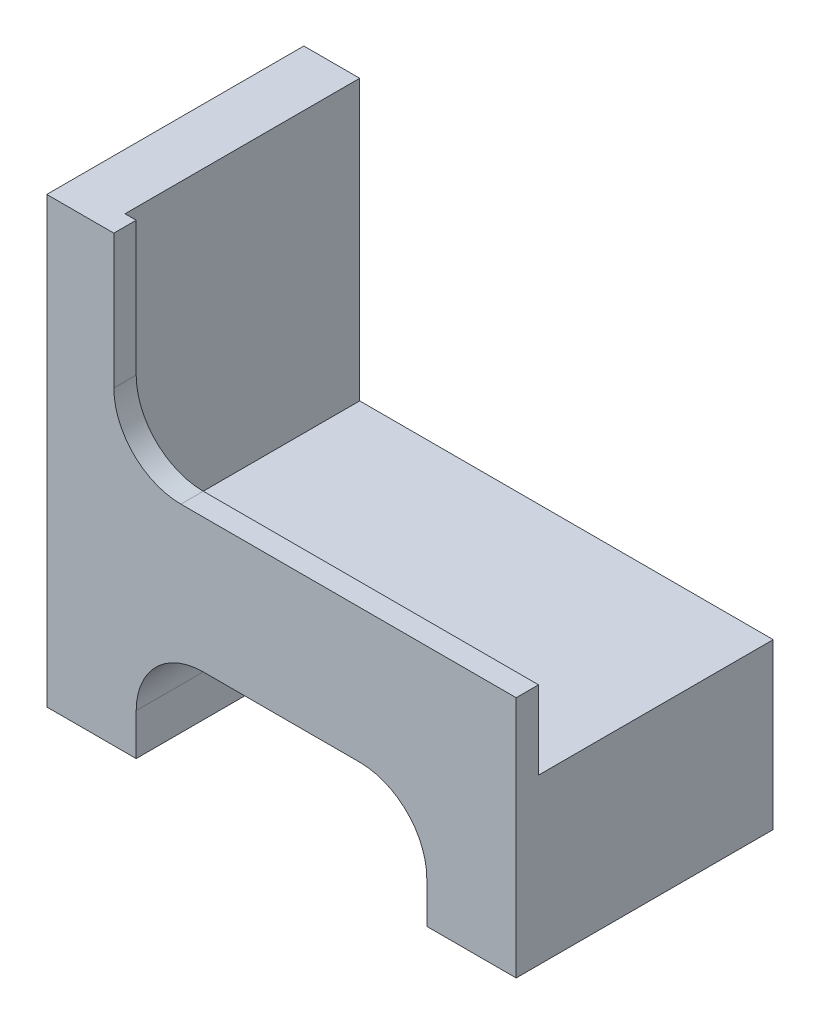
from build123d import *

# Parameters (mm, degrees)
EXTRUDE_1_DEPTH        = 10
SKETCH_2_R             = 0.95
CUT_EXTRUDE_1_DEPTH    = 5
FILLET_1_R             = 3
CHAMFER_2_SIZE         = 1
EXTRUDE_START          = 1.5
EXTRUDE_2_DEPTH        = 1.5
FILLET_2_R             = 3
SKETCH_5_W             = 18.894194267
SKETCH_5_H             = 13.568314004
CUT_EXTRUDE_1877_DEPTH = 10.5


with BuildPart() as part:
    # 草图1 → 凸台-拉伸1 (new body)
    with BuildSketch(Plane.XY):
        Polygon((0, 0), (18, 0), (18, -7.86), (14, -7.86), (14, -3), (1, -3), (1, -7.86), (-3, -7.86), (-3, 12), (0, 12), align=None)
    extrude(amount=EXTRUDE_1_DEPTH)

    # 草图2 → 切除-拉伸1 (cut)
    with BuildSketch(Plane.XZ.offset(7.86)):
        with Locations((-1, 5)):
            Circle(SKETCH_2_R)
        with Locations((16, 5.10136652)):
            Circle(SKETCH_2_R)
    extrude(amount=-CUT_EXTRUDE_1_DEPTH, mode=Mode.SUBTRACT)

    # 圆角1
    fillet_1_edges = [part.edges().sort_by_distance(p)[0] for p in [
        (14, -3, 5),
        (1, -3, 5),
    ]]
    fillet(fillet_1_edges, radius=FILLET_1_R)

    # 倒角2
    chamfer_2_edges = [part.edges().sort_by_distance(p)[0] for p in [
        (15.05, -7.86, 5.10136652),
        (-1.95, -7.86, 5),
    ]]
    chamfer(chamfer_2_edges, length=CHAMFER_2_SIZE)

    # 草图4 → 凸台-拉伸2 (add)
    with BuildSketch(Plane.XY.offset(10).offset(EXTRUDE_START)):
        with BuildLine():
            Line((0, 12), (0, 3))
            Line((0, 3), (18, 3))
            Line((18, 3), (18, 0))
            Line((18, 0), (18, -7.86))
            Line((18, -7.86), (14, -7.86))
            Line((14, -7.86), (14, -6))
            ThreePointArc((14, -6), (13.121320344, -3.878679656), (11, -3))
            Line((11, -3), (4, -3))
            ThreePointArc((4, -3), (1.878679656, -3.878679656), (1, -6))
            Line((1, -6), (1, -7.86))
            Line((1, -7.86), (-3, -7.86))
            Line((-3, -7.86), (-3, 12))
            Line((-3, 12), (0, 12))
        make_face()
    extrude(amount=-EXTRUDE_2_DEPTH)

    # 圆角2
    fillet_2_edges = [part.edges().sort_by_distance(p)[0] for p in [
        (0, 3, 10.75),
    ]]
    fillet(fillet_2_edges, radius=FILLET_2_R)

    # 草图5 → Cut-Extrude 1877 (cut)
    with BuildSketch(Plane(origin=(0, 0, 0), x_dir=(-1, 0, 0), z_dir=(0, 0, -1))):
        with Locations((-8.947097133, 6.284157002)):
            Rectangle(SKETCH_5_W, SKETCH_5_H)
    extrude(amount=-CUT_EXTRUDE_1877_DEPTH, mode=Mode.SUBTRACT)


solid = part.part
